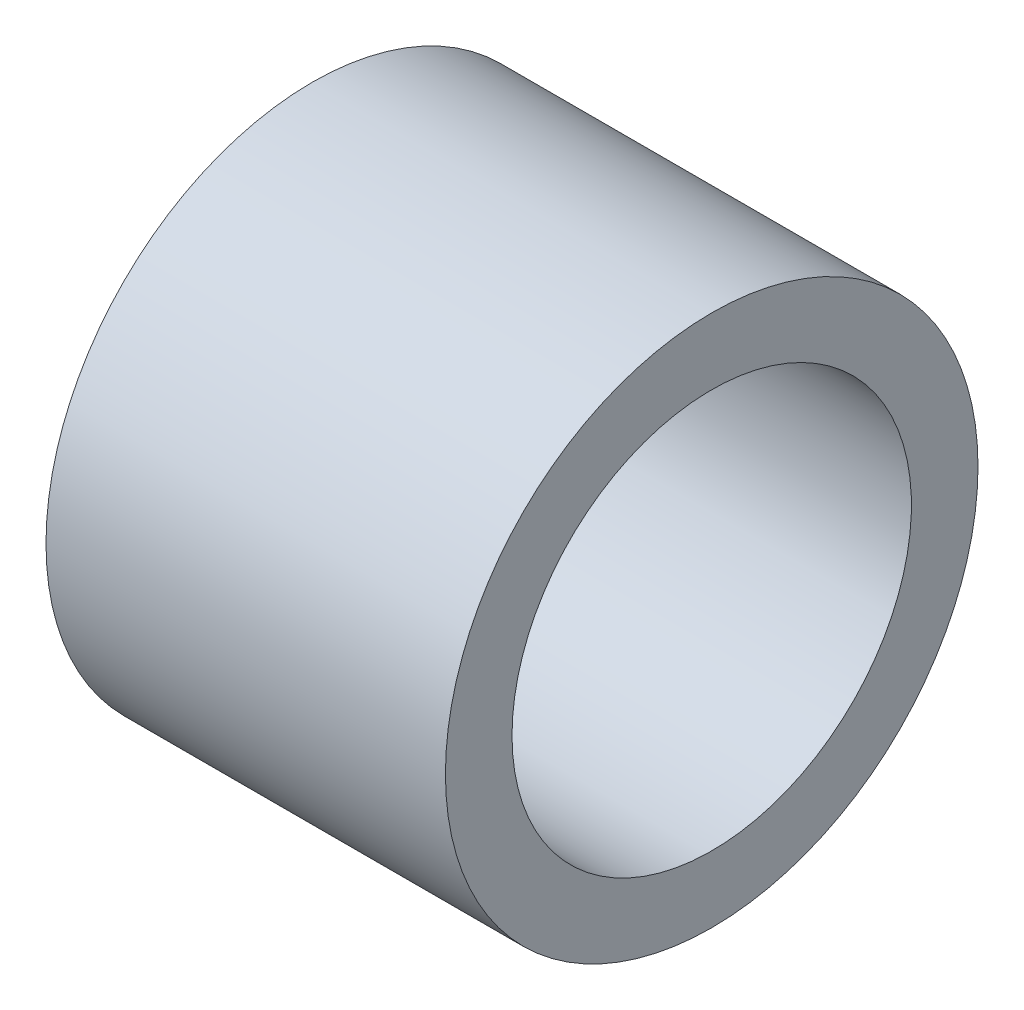
from build123d import *

# Parameters (mm, degrees)
SKETCH3_R           = 12.7
SKETCH3_R_2         = 9.525
BOSS_EXTRUDE1_DEPTH = 9.525


with BuildPart() as part:
    # Sketch3 → Boss-Extrude1 (new, symmetric)
    with BuildSketch(Plane(origin=(0, 0, 0), x_dir=(0, 0, -1), z_dir=(1, 0, 0))):
        with Locations(Location((0, 0, 0), (0, 0, 180))):
            Circle(SKETCH3_R)
        with Locations(Location((0, 0, 0), (0, 0, 180))):
            Circle(SKETCH3_R_2, mode=Mode.SUBTRACT)
    extrude(amount=BOSS_EXTRUDE1_DEPTH, both=True)


solid = part.part
